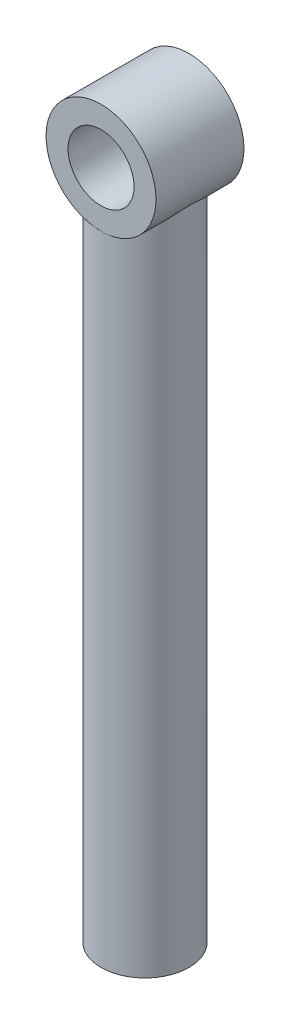
from build123d import *

# Parameters (mm, degrees)
SKETCH_1_R      = 10
SKETCH_1_R_2    = 5
EXTRUDE_1_DEPTH = 75
SKETCH_2_R      = 12.5
SKETCH_2_R_2    = 7.5
EXTRUDE_2_DEPTH = 10


with BuildPart() as part:
    # 스케치1 → 보스-돌출1 (new, symmetric)
    with BuildSketch(Plane(origin=(0, 0, 0), x_dir=(1, 0, 0), z_dir=(0, 1, 0))):
        with Locations(Location((0, 0, 0), (0, 0, 270))):
            Circle(SKETCH_1_R)
        with Locations(Location((0, 0, 0), (0, 0, 270))):
            Circle(SKETCH_1_R_2, mode=Mode.SUBTRACT)
    extrude(amount=EXTRUDE_1_DEPTH, both=True)

    # 스케치2 → 보스-돌출2 (add, symmetric)
    with BuildSketch(Plane.XY):
        with Locations((0, 82.5)):
            Circle(SKETCH_2_R)
        with Locations((0, 82.5)):
            Circle(SKETCH_2_R_2, mode=Mode.SUBTRACT)
    extrude(amount=EXTRUDE_2_DEPTH, both=True)


solid = part.part
